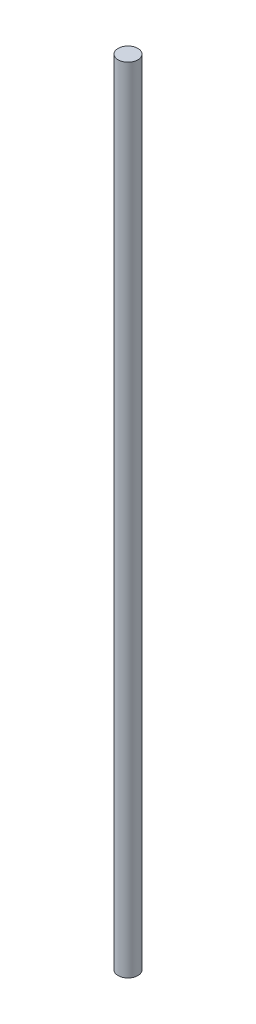
from build123d import *

# Parameters (mm, degrees)
SKETCH_1_R      = 1.5
EXTRUDE_1_DEPTH = 120


with BuildPart() as part:
    # 草图1 → 凸台-拉伸1 (new body)
    with BuildSketch(Plane(origin=(0, 0, 0), x_dir=(1, 0, 0), z_dir=(0, 1, 0))):
        with Locations(Location((0, 0, 0), (0, 0, 270))):
            Circle(SKETCH_1_R)
    extrude(amount=EXTRUDE_1_DEPTH)


solid = part.part
